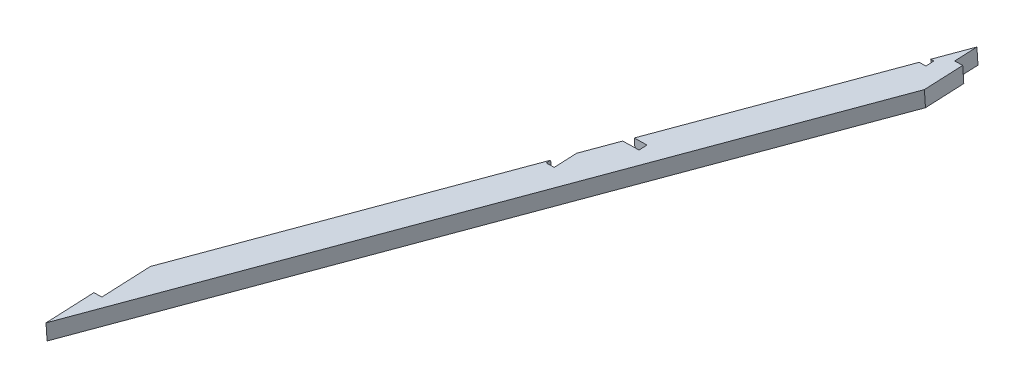
from build123d import *

# Parameters (mm, degrees)
BOSS_EXTRUDE1_DEPTH = 6.35


with BuildPart() as part:
    # Sketch1 → Boss-Extrude1 (new body)
    with BuildSketch(Plane(origin=(-0.90473349, 43.561026462, 2.027115131), x_dir=(0.9997848521926148, 0.020721741287877123, 0.00092669530585148), z_dir=(-0.020742418293810922, 0.9987040847793697, 0.046474757969528636))):
        Polygon((375.394170483, 337.521870175), (267.665920179, 95.86081172), (267.666635537, 114.910811707), (270.841635535, 114.910692481), (270.842359057, 134.178118188), (319.943496899, 244.32409112), (319.943496899, 242.556399877), (323.118496899, 242.556399877), (323.118496899, 251.446399877), (328.779933572, 264.146399877), (335.275292741, 264.146399877), (335.275292741, 267.321399877), (330.195292741, 267.321399877), (365.137535857, 345.705476779), (367.822895026, 345.705476779), (367.822895026, 348.880476779), (366.552895026, 348.880476779), (372.219755026, 361.592642641), (372.219755026, 352.761870175), (375.394755026, 352.761870175), align=None)
    extrude(amount=-BOSS_EXTRUDE1_DEPTH)


solid = part.part
